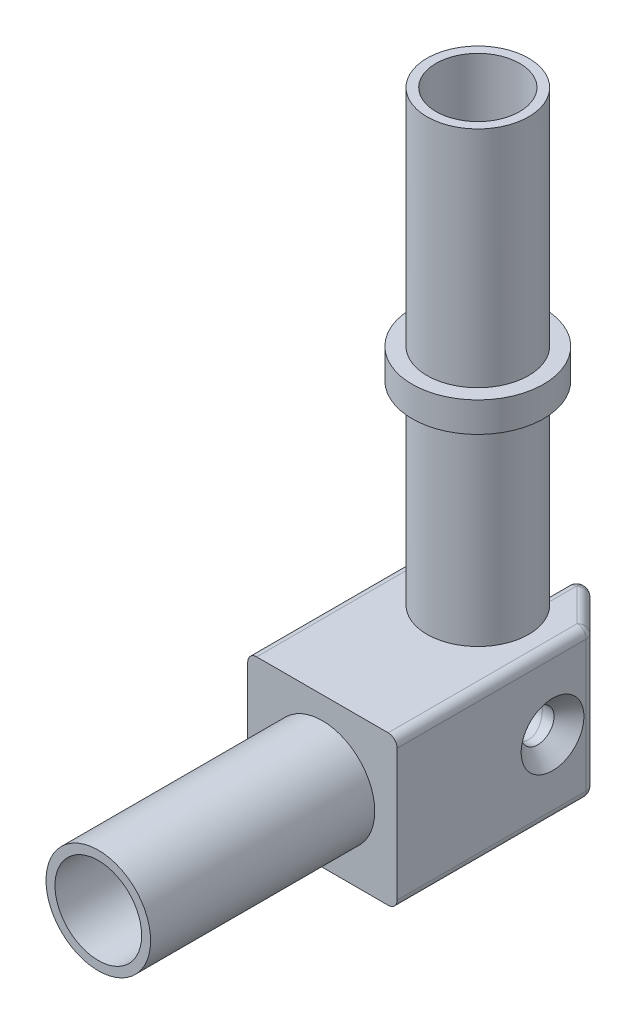
from build123d import *

# Parameters (mm, degrees)
SKETCH1_W               = 75
SKETCH1_H               = 75
BOSS_EXTRUDE1_DEPTH     = 8
FILLET1_R               = 10
SKETCH2_R               = 17.5
BOSS_EXTRUDE2_DEPTH     = 37.5
SKETCH3_R               = 17
BOSS_EXTRUDE3_DEPTH     = 200
SKETCH4_R               = 22
SKETCH4_R_2             = 17
BOSS_EXTRUDE4_DEPTH     = 10
BOSS_EXTRUDE5_DEPTH     = 50
SKETCH6_R               = 17.5
CUT_EXTRUDE1_DEPTH      = 25
SKETCH7_R               = 17.5
BOSS_EXTRUDE6_DEPTH     = 100
CUT_EXTRUDE2_DEPTH      = 235.438691346
CUT_EXTRUDE2_DEPTH_BACK = 235.438691346
SKETCH8_R               = 5.5
CUT_EXTRUDE3_DEPTH      = 258.012159245
CUT_EXTRUDE3_DEPTH_BACK = 258.012159245
SKETCH10_R              = 14
CHAMFER1_SIZE           = 5
CUT_EXTRUDE4_DEPTH      = 12
FILLET3_R               = 3
FILLET2_R               = 3
SKETCH12_R              = 14.5
CUT_EXTRUDE5_DEPTH      = 224.909021776


with BuildPart() as part:
    # Sketch1 → Boss-Extrude1 (new body)
    with BuildSketch(Plane.XY):
        Rectangle(SKETCH1_W, SKETCH1_H)
    extrude(amount=BOSS_EXTRUDE1_DEPTH)

    # Fillet1
    fillet1_edges = [part.edges().sort_by_distance(p)[0] for p in [
        (37.5, -37.5, 4),
        (-37.5, -37.5, 4),
        (-37.5, 37.5, 4),
        (37.5, 37.5, 4),
    ]]
    fillet(fillet1_edges, radius=FILLET1_R)

    # Sketch2 → Boss-Extrude2 (add, symmetric)
    with BuildSketch(Plane(origin=(0, 0, 0), x_dir=(1, 0, 0), z_dir=(0, 1, 0))):
        with BuildLine():
            Line((-27.5, -8), (-27.5, -30))
            ThreePointArc((-27.5, -30), (0, -57.5), (27.5, -30))
            Line((27.5, -30), (27.5, -8))
            Line((27.5, -8), (-27.5, -8))
        make_face()
        with Locations(Location((0, -30, 0), (0, 0, 270))):
            Circle(SKETCH2_R, mode=Mode.SUBTRACT)
    extrude(amount=BOSS_EXTRUDE2_DEPTH, both=True)


with BuildPart() as body_2:
    # Sketch3 → Boss-Extrude3 (new body)
    with BuildSketch(Plane(origin=(0, 37.5, 0), x_dir=(1, 0, 0), z_dir=(0, 1, 0))):
        with Locations(Location((0, -30, 0), (0, 0, 270))):
            Circle(SKETCH3_R)
    extrude(amount=-BOSS_EXTRUDE3_DEPTH)

    # Sketch4 → Boss-Extrude4 (add)
    with BuildSketch(Plane.XZ.offset(37.5)):
        with Locations(Location((0, 30, 0), (0, 0, 270))):
            Circle(SKETCH4_R)
        with Locations(Location((0, 30, 0), (0, 0, 90))):
            Circle(SKETCH4_R_2, mode=Mode.SUBTRACT)
    extrude(amount=BOSS_EXTRUDE4_DEPTH)


with BuildPart() as body_3:
    # Sketch5 → Boss-Extrude5 (new body)
    with BuildSketch(Plane.XZ.offset(162.5)):
        with BuildLine():
            Line((-8, 15), (-8, 5))
            Line((-8, 5), (-12.5, 5))
            Line((-12.5, 5), (-25, 17.5))
            Line((-25, 17.5), (-25, 82))
            Line((-25, 82), (0, 82))
            Line((0, 82), (0, 47))
            ThreePointArc((0, 47), (-16.492422502, 34.123105626), (-8, 15))
        make_face()
    extrude(amount=-BOSS_EXTRUDE5_DEPTH)

    # Mirror1: body 3 across plane


with BuildPart() as body_3_1:
    add(body_3.part)
    add(body_3.part.mirror(Plane(origin=(0, -112.5, 82), x_dir=(0, 0, 1), z_dir=(1, 0, 0))))

    # Sketch6 → Cut-Extrude1 (cut)
    with BuildSketch(Plane.XY.offset(82)):
        with Locations((0, -137.5)):
            Circle(SKETCH6_R)
    extrude(amount=-CUT_EXTRUDE1_DEPTH, mode=Mode.SUBTRACT)


with BuildPart() as body_4:
    # Sketch7 → Boss-Extrude6 (new body)
    with BuildSketch(Plane.XY.offset(57)):
        with Locations((0, -137.5)):
            Circle(SKETCH7_R)
    extrude(amount=BOSS_EXTRUDE6_DEPTH)

    # Sketch12 → Cut-Extrude5 (cut, through all)
    with BuildSketch(Plane.XY.offset(157)):
        with Locations((0, -137.5)):
            Circle(SKETCH12_R)
    extrude(amount=-CUT_EXTRUDE5_DEPTH, mode=Mode.SUBTRACT)


with BuildPart() as cut_extrude2_tool:
    # Sketch8 → Cut-Extrude2 (new, two sides: drawn at the far end of the back side and taken through both)
    with BuildSketch(Plane(origin=(25, 0, 0), x_dir=(0, 0, -1), z_dir=(1, 0, 0)).offset(-CUT_EXTRUDE2_DEPTH_BACK)):
        with Locations((-30, -137.5)):
            Circle(SKETCH8_R)
    extrude(amount=CUT_EXTRUDE2_DEPTH + CUT_EXTRUDE2_DEPTH_BACK)


with BuildPart() as body_2_1:
    add(body_2.part)

    # Cut-Extrude2: cut by cut_extrude2_tool
    add(cut_extrude2_tool.part, mode=Mode.SUBTRACT)

    # Sketch10 → Cut-Extrude3 (cut, two sides: drawn at the far end of the back side and taken through both)
    with BuildSketch(Plane.XZ.offset(162.5).offset(-CUT_EXTRUDE3_DEPTH_BACK)):
        with Locations(Location((0, 30, 0), (0, 0, 270))):
            Circle(SKETCH10_R)
    extrude(amount=CUT_EXTRUDE3_DEPTH + CUT_EXTRUDE3_DEPTH_BACK, mode=Mode.SUBTRACT)


with BuildPart() as body_3_2:
    add(body_3_1.part)

    # Cut-Extrude2: cut by cut_extrude2_tool
    add(cut_extrude2_tool.part, mode=Mode.SUBTRACT)

    # Chamfer1
    chamfer1_edges = [body_3_2.edges().sort_by_distance(p)[0] for p in [
        (25, -137.5, 35.5),
    ]]
    chamfer(chamfer1_edges, length=CHAMFER1_SIZE)

    # Sketch11 → Cut-Extrude4 (cut)
    with BuildSketch(Plane.ZY.offset(25)):
        Polygon((39, -142.696152423), (39, -132.303847577), (30, -127.107695155), (21, -132.303847577), (21, -142.696152423), (30, -147.892304845), align=None)
    extrude(amount=-CUT_EXTRUDE4_DEPTH, mode=Mode.SUBTRACT)

    # Fillet3
    fillet3_edges = [body_3_2.edges().sort_by_distance(p)[0] for p in [
        (-8, -137.5, 5),
        (-12.5, -137.5, 5),
        (-25, -137.5, 17.5),
        (8, -137.5, 5),
        (12.5, -137.5, 5),
        (25, -137.5, 17.5),
    ]]
    fillet(fillet3_edges, radius=FILLET3_R)

    # Fillet2
    fillet2_edges = [body_3_2.edges().sort_by_distance(p)[0] for p in [
        (12.40540961, -162.5, 5.228361402),
        (-12.40540961, -162.5, 5.228361402),
        (-11.128679656, -112.5, 5),
        (-8, -112.5, 11.5),
        (18.75, -112.5, 11.25),
        (11.128679656, -112.5, 5),
        (8, -112.5, 11.5),
        (-24.771638598, -112.5, 17.59459039),
        (24.771638598, -112.5, 17.59459039),
        (-8.878679656, -112.5, 5.878679656),
        (8.878679656, -112.5, 5.878679656),
        (12.40540961, -112.5, 5.228361402),
        (-12.40540961, -112.5, 5.228361402),
        (-25, -112.5, 50.371320344),
        (25, -162.5, 50.371320344),
        (25, -112.5, 50.371320344),
        (-25, -162.5, 50.371320344),
        (-18.75, -162.5, 11.25),
        (-18.75, -112.5, 11.25),
        (8, -162.5, 11.5),
        (11.128679656, -162.5, 5),
        (18.75, -162.5, 11.25),
        (-11.128679656, -162.5, 5),
        (-8, -162.5, 11.5),
        (-24.771638598, -162.5, 17.59459039),
        (24.771638598, -162.5, 17.59459039),
        (-8.878679656, -162.5, 5.878679656),
        (8.878679656, -162.5, 5.878679656),
    ]]
    fillet(fillet2_edges, radius=FILLET2_R)


solid = Compound([body_4.part, body_2_1.part, body_3_2.part])
